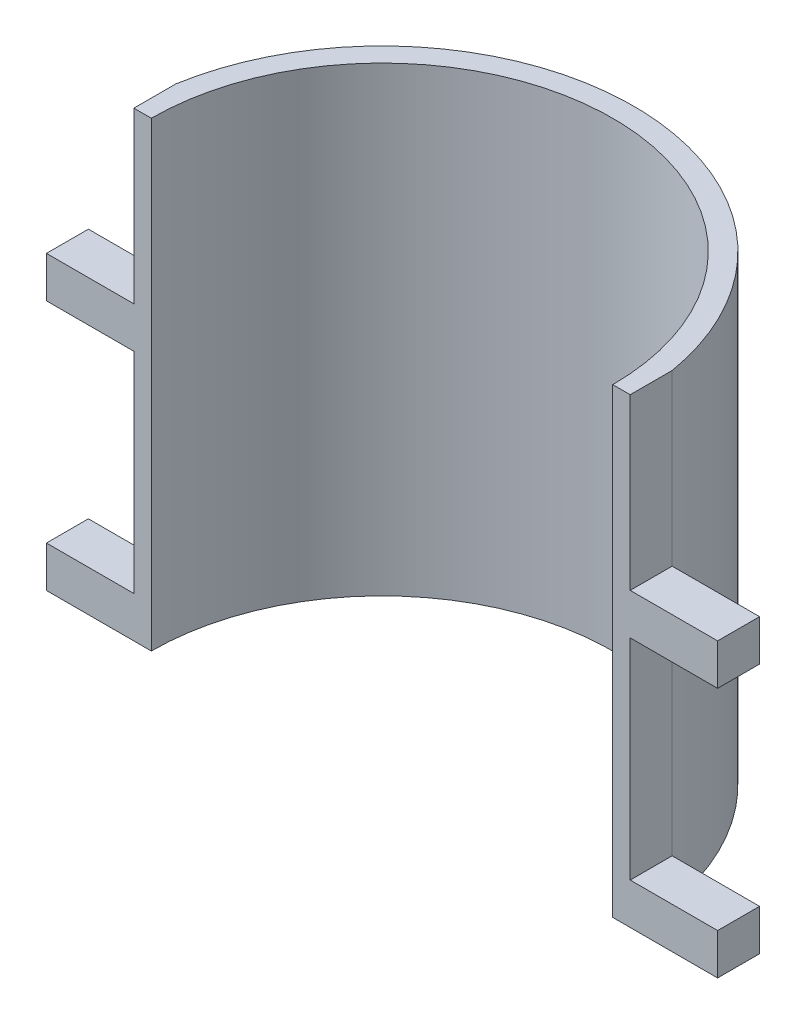
from build123d import *

# Parameters (mm, degrees)
BOSS_EXTRUDE1_DEPTH = 110
SKETCH3_W           = 20.839202169
SKETCH3_H           = 50
SKETCH3_H_2         = 40.4
CUT_EXTRUDE1_DEPTH  = 110


with BuildPart() as part:
    # Sketch1 → Boss-Extrude1 (new body)
    with BuildSketch(Plane(origin=(0, 0, 0), x_dir=(1, 0, 0), z_dir=(0, 1, 0))):
        with BuildLine():
            ThreePointArc((-55, 0), (0, 55), (55, 0))
            Line((55, 0), (55, 10))
            Line((55, 10), (59.160797831, 10))
            ThreePointArc((59.160797831, 10), (0, 60), (-59.160797831, 10))
            Line((-59.160797831, 10), (-55, 10))
            Line((-55, 10), (-55, 0))
        make_face()
        with BuildLine():
            Line((-60, 0), (-55, 0))
            Line((-55, 0), (-55, 10))
            Line((-55, 10), (-59.160797831, 10))
            ThreePointArc((-59.160797831, 10), (-59.789831367, 5.017575617), (-60, 0))
        make_face()
        with BuildLine():
            ThreePointArc((-60, 0), (-59.789831367, 5.017575617), (-59.160797831, 10))
            Line((-59.160797831, 10), (-80, 10))
            Line((-80, 10), (-80, 0))
            Line((-80, 0), (-60, 0))
        make_face()
        with BuildLine():
            Line((60, 0), (80, 0))
            Line((80, 0), (80, 10))
            Line((80, 10), (59.160797831, 10))
            ThreePointArc((59.160797831, 10), (59.789831367, 5.017575617), (60, 0))
        make_face()
        with BuildLine():
            Line((55, 0), (60, 0))
            ThreePointArc((60, 0), (59.789831367, 5.017575617), (59.160797831, 10))
            Line((59.160797831, 10), (55, 10))
            Line((55, 10), (55, 0))
        make_face()
    extrude(amount=BOSS_EXTRUDE1_DEPTH)

    # Sketch3 → Cut-Extrude1 (cut)
    with BuildSketch(Plane(origin=(0, 0, -10), x_dir=(-1, 0, 0), z_dir=(0, 0, -1))):
        with Locations((-69.580398915, 34.8)):
            Rectangle(SKETCH3_W, SKETCH3_H)
        with Locations((69.580398915, 34.8)):
            Rectangle(SKETCH3_W, SKETCH3_H)
        with Locations((-69.580398915, 89.8)):
            Rectangle(SKETCH3_W, SKETCH3_H_2)
        with Locations((69.580398915, 89.8)):
            Rectangle(SKETCH3_W, SKETCH3_H_2)
    extrude(amount=-CUT_EXTRUDE1_DEPTH, mode=Mode.SUBTRACT)


solid = part.part
